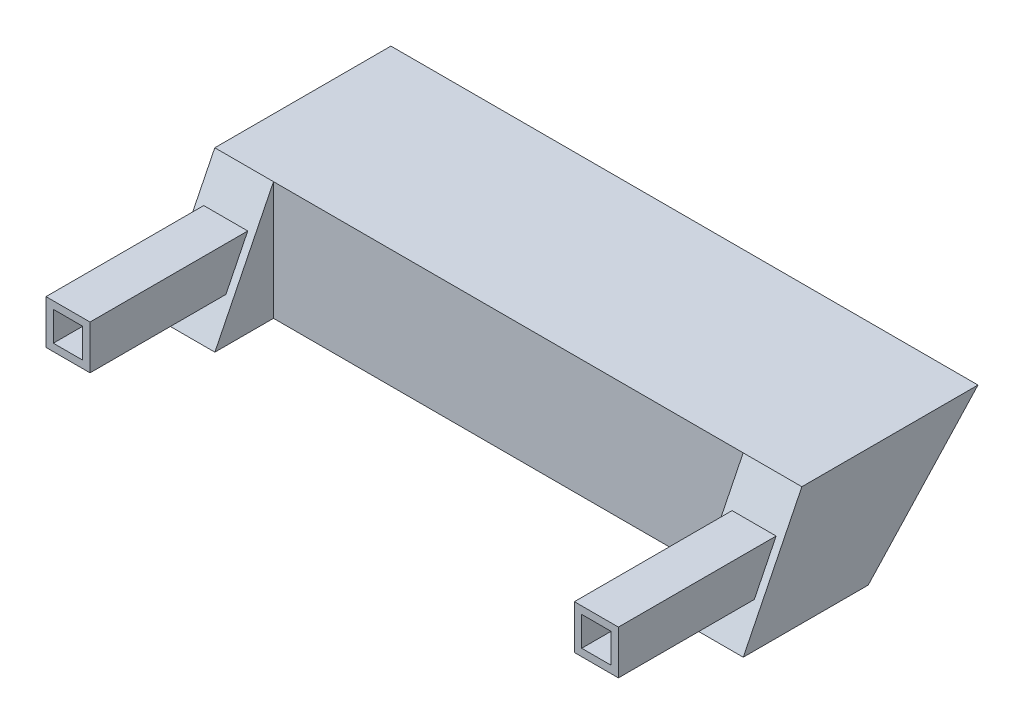
from build123d import *

# Parameters (mm, degrees)
BOSS_EXTRUDE1_DEPTH = 127
BOSS_EXTRUDE2_START = 101.6
BOSS_EXTRUDE2_DEPTH = 25.4
SKETCH4_W           = 19.05
SKETCH4_H           = 19.05
SKETCH4_W_2         = 12.7
SKETCH4_H_2         = 12.7
BOSS_EXTRUDE3_DEPTH = 76.2


with BuildPart() as part:
    # Sketch1 → Boss-Extrude1 (new, symmetric)
    with BuildSketch(Plane(origin=(0, 0, 0), x_dir=(0, 0, -1), z_dir=(1, 0, 0))):
        Polygon((0, 0), (0, 51.214865967), (76.2, 51.214865967), (28.702, 0), align=None)
    extrude(amount=BOSS_EXTRUDE1_DEPTH, both=True)

    # Sketch3 → Boss-Extrude2 (add)
    with BuildSketch(Plane(origin=(0, 0, 0), x_dir=(0, 0, -1), z_dir=(1, 0, 0)).offset(BOSS_EXTRUDE2_START)):
        Polygon((0, 51.214865967), (-25.360599441, 0), (0, 0), align=None)
    boss_extrude2 = extrude(amount=BOSS_EXTRUDE2_DEPTH)

    # Mirror1: Boss-Extrude2 across plane
    add(boss_extrude2.mirror(Plane(origin=(0, 0, 0), x_dir=(0, 0, 1), z_dir=(1, 0, 0))))

    # Sketch4 → Boss-Extrude3 (add)
    with BuildSketch(Plane.XY):
        with Locations((114.3, 25.607432983)):
            Rectangle(SKETCH4_W, SKETCH4_H)
        with Locations((114.3, 25.607432983)):
            Rectangle(SKETCH4_W_2, SKETCH4_H_2, mode=Mode.SUBTRACT)
    boss_extrude3 = extrude(amount=BOSS_EXTRUDE3_DEPTH)

    # Mirror2: Boss-Extrude3 across plane
    add(boss_extrude3.mirror(Plane(origin=(0, 0, 0), x_dir=(0, 0, 1), z_dir=(1, 0, 0))))


solid = part.part
